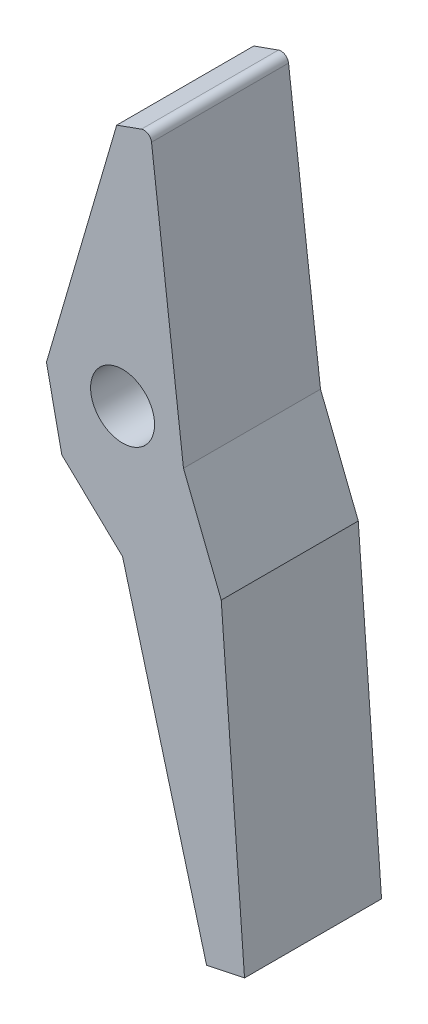
from build123d import *

# Parameters (mm, degrees)
SKETCH_1_R          = 2.1
EXTRUDE_1_DEPTH     = 4.5
SKETCH_2_R          = 2.4
EXTRUDE_2_DEPTH     = 2
FILLET_1_R          = 1.75
CUT_EXTRUDE_START   = -2
SKETCH_3_R          = 3.1
SKETCH_3_R_2        = 2.4
CUT_EXTRUDE_1_DEPTH = 2
FILLET_3_R          = 0.5


with BuildPart() as part:
    # 스케치1 → 보스-돌출1 (new, symmetric)
    with BuildSketch(Plane.XY):
        Polygon((-5, 0), (-0.385221799, 15.795303231), (1.827127146, 16.587775404), (4, -1.531866144), (6.479836305, -7.789788004), (8.009600242, -28.520515794), (5.517735363, -29.047476782), (0, -8.554669972), (-3.992979216, -4.761945907), align=None)
        Circle(SKETCH_1_R, mode=Mode.SUBTRACT)
    extrude(amount=EXTRUDE_1_DEPTH, both=True)

    # 스케치2 → 보스-돌출2 (add)
    with BuildSketch(Plane(origin=(-4.606773657, 1.345921527, 0), x_dir=(0, 0, 1), z_dir=(-0.9598722474471307, 0.2804376375966574, 0))):
        with Locations(Location((0, 8, 0), (0, 0, 90))):
            Circle(SKETCH_2_R)
    extrude(amount=EXTRUDE_2_DEPTH)

    # 필렛1
    fillet_1_edges = [part.edges().sort_by_distance(p)[0] for p in [
        (-4.956067381, 7.282081388, 0),
    ]]
    fillet(fillet_1_edges, radius=FILLET_1_R)

    # 스케치3 → 컷-돌출1 (cut)
    with BuildSketch(Plane(origin=(-4.606773657, 1.345921527, 0), x_dir=(0, 0, 1), z_dir=(-0.9598722474471308, 0.28043763759665746, 0)).offset(CUT_EXTRUDE_START)):
        with Locations(Location((0, 8, 0), (0, 0, 270))):
            Circle(SKETCH_3_R)
        with Locations(Location((0, 8, 0), (0, 0, 270))):
            Circle(SKETCH_3_R_2, mode=Mode.SUBTRACT)
    extrude(amount=CUT_EXTRUDE_1_DEPTH, mode=Mode.SUBTRACT)

    # 필렛3
    fillet_3_edges = [part.edges().sort_by_distance(p)[0] for p in [
        (1.827127146, 16.587775404, 0),
    ]]
    fillet(fillet_3_edges, radius=FILLET_3_R)


solid = part.part
